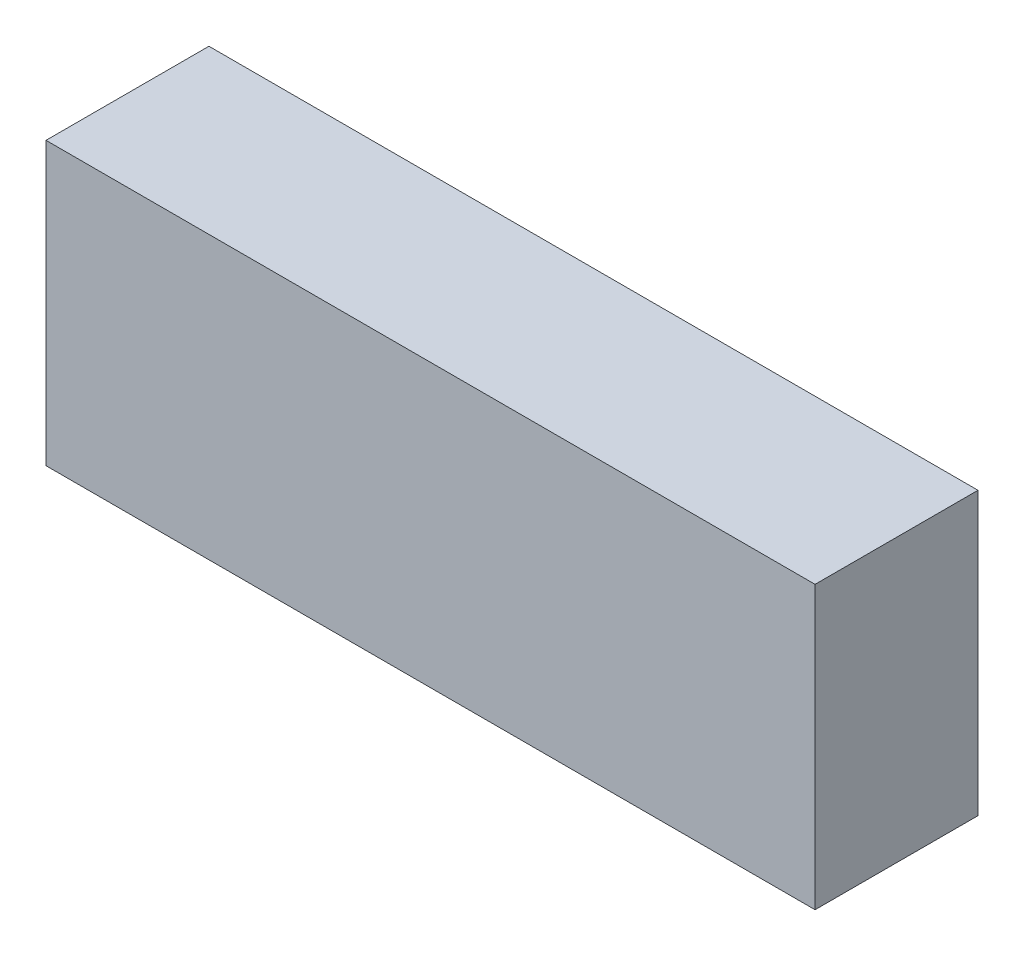
from build123d import *

# Parameters (mm, degrees)
SKETCH1_W                 = 34.22130149
SKETCH1_H                 = 12.54
BOSS_EXTRUDE1_DEPTH       = 7.25
SHELL1_T                  = -0.5
SHELL1_THICKNESS_2_FACE_W = 33.22130149
SHELL1_THICKNESS_2_FACE_H = 11.54
SHELL1_THICKNESS_2_DEPTH  = 0.3


with BuildPart() as part:
    # Sketch1 → Boss-Extrude1 (new body)
    with BuildSketch(Plane.XY):
        with Locations((-61.926150745, -23.9)):
            Rectangle(SKETCH1_W, SKETCH1_H)
    extrude(amount=BOSS_EXTRUDE1_DEPTH)

    # Shell1
    shell1_openings = [part.faces().sort_by_distance(p)[0] for p in [
        (-61.926150745, -23.9, 0),
    ]]
    offset(amount=SHELL1_T, openings=shell1_openings, kind=Kind.INTERSECTION)

    # Shell1 thickness 2 face (on inner face of the shell) → Shell1 thickness 2 (cut)
    with BuildSketch(Plane(origin=(-61.926150745, -23.9, 6.75), x_dir=(1, 0, 0), z_dir=(0, 0, 1))):
        Rectangle(SHELL1_THICKNESS_2_FACE_W, SHELL1_THICKNESS_2_FACE_H)
    extrude(amount=SHELL1_THICKNESS_2_DEPTH, mode=Mode.SUBTRACT)


solid = part.part
